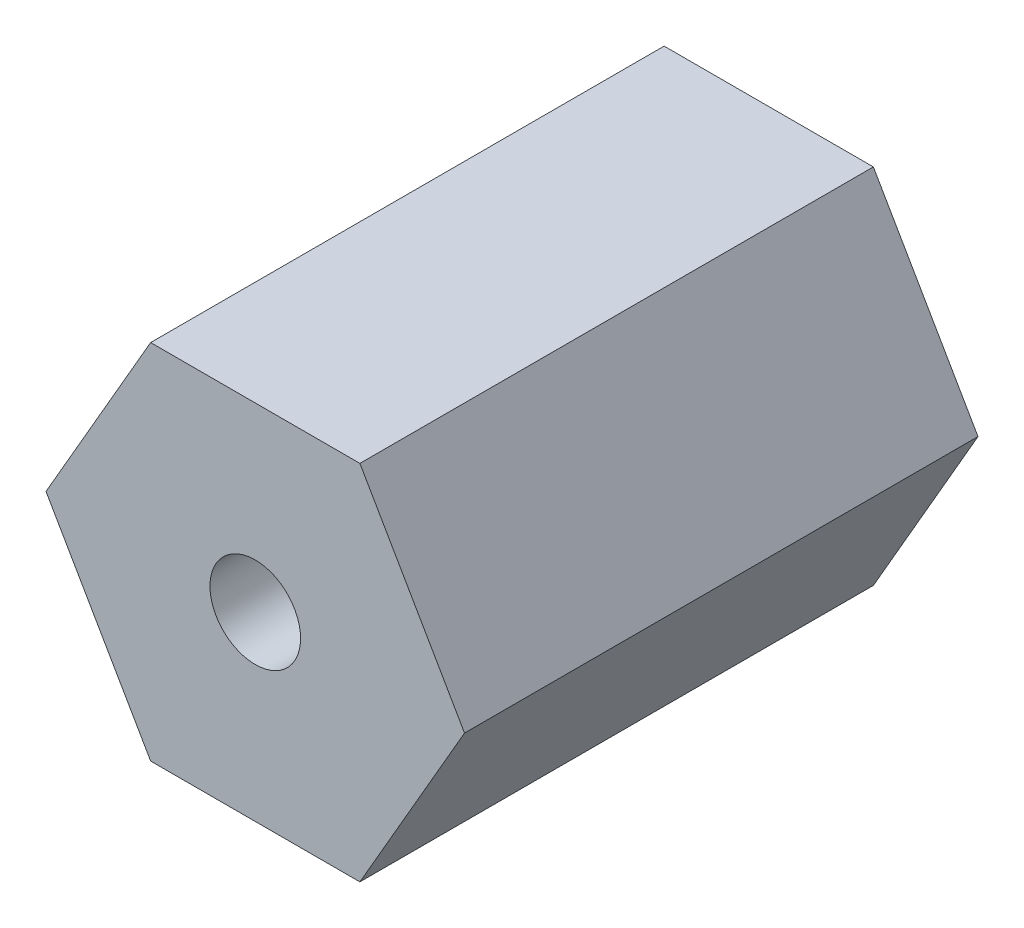
from build123d import *

# Parameters (mm, degrees)
SKETCH1_R           = 1.5
BOSS_EXTRUDE1_DEPTH = 17


with BuildPart() as part:
    # Sketch1 → Boss-Extrude1 (new body)
    with BuildSketch(Plane.XY):
        Polygon((6.92820323, 0), (3.464101615, 6), (-3.464101615, 6), (-6.92820323, 0), (-3.464101615, -6), (3.464101615, -6), align=None)
        Circle(SKETCH1_R, mode=Mode.SUBTRACT)
    extrude(amount=BOSS_EXTRUDE1_DEPTH)


solid = part.part
